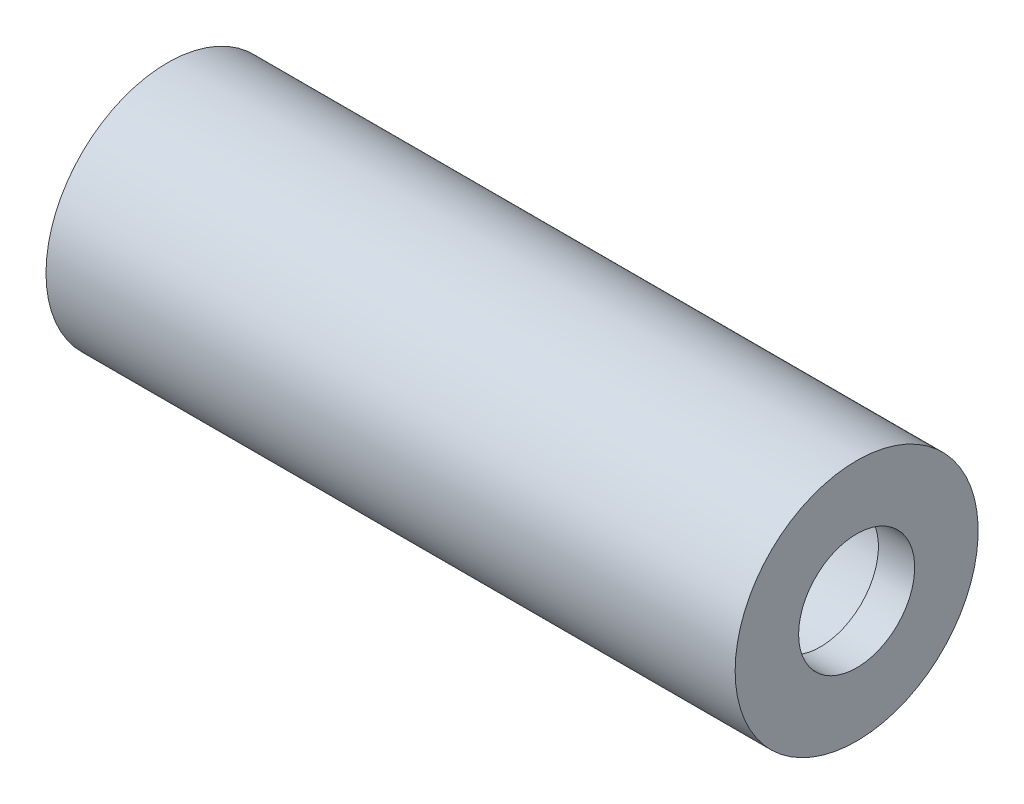
from build123d import *


with BuildPart() as part:
    # Sketch1 → Revolve1 (revolve)
    with BuildSketch(Plane.XY, mode=Mode.PRIVATE) as revolve1_sk:
        Polygon((0, 3.35), (19, 3.35), (19, 1.6), (18, 1.6), (18, 2.35), (0, 2.35), align=None)
    revolve(revolve1_sk.sketch.rotate(Axis((0, 0, 0), (1, 0, 0)), 90), axis=Axis((0, 0, 0), (1, 0, 0)))


solid = part.part
